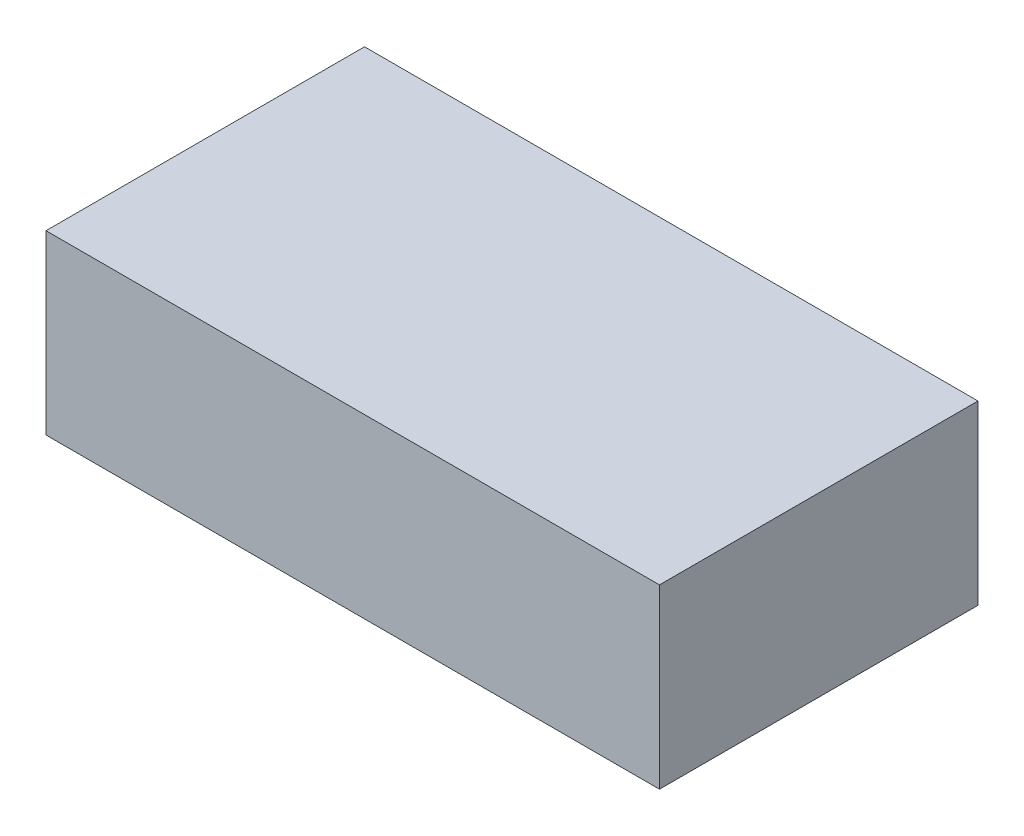
from build123d import *

# Parameters (mm, degrees)
SKETCH_1_W      = 52
SKETCH_1_H      = 27
EXTRUDE_1_DEPTH = 15


with BuildPart() as part:
    # 草图1 → 凸台-拉伸1 (new body)
    with BuildSketch(Plane(origin=(0, 0, 0), x_dir=(1, 0, 0), z_dir=(0, 1, 0))):
        with Locations((26, -13.5)):
            Rectangle(SKETCH_1_W, SKETCH_1_H)
    extrude(amount=EXTRUDE_1_DEPTH)


solid = part.part
